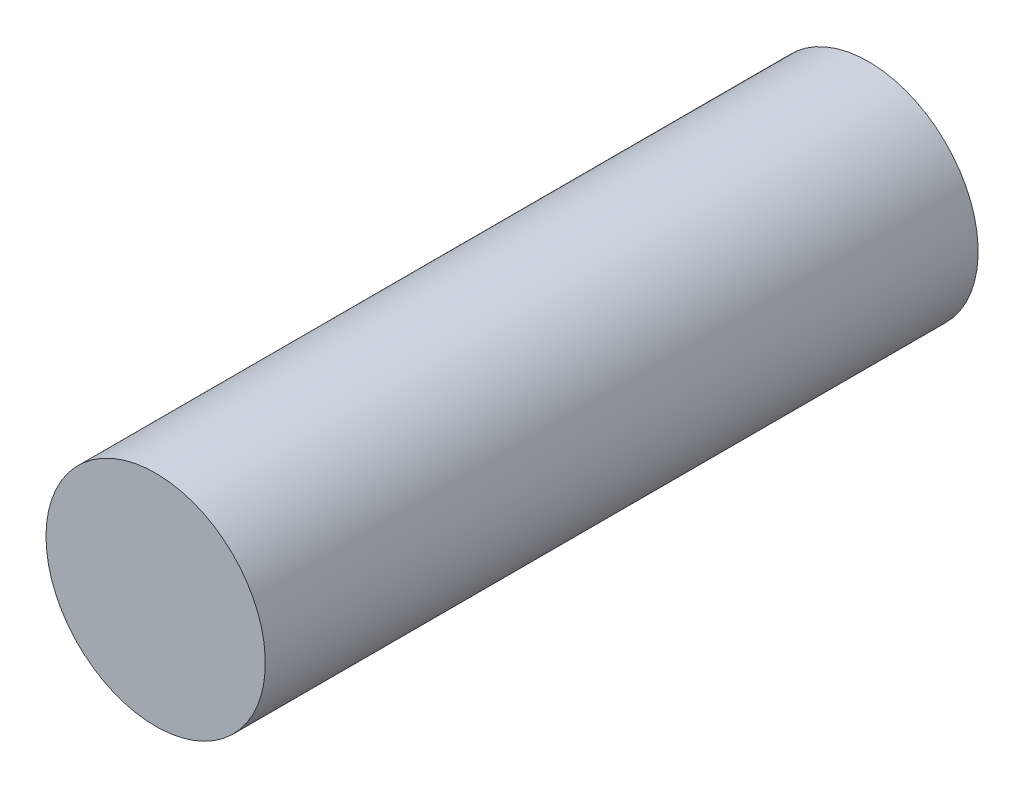
from build123d import *

# Parameters (mm, degrees)
SKETCH1_R           = 2
BOSS_EXTRUDE1_DEPTH = 13


with BuildPart() as part:
    # Sketch1 → Boss-Extrude1 (new body)
    with BuildSketch(Plane.XY):
        with Locations(Location((0, 0, 0), (0, 0, 180))):
            Circle(SKETCH1_R)
    extrude(amount=BOSS_EXTRUDE1_DEPTH)


solid = part.part
